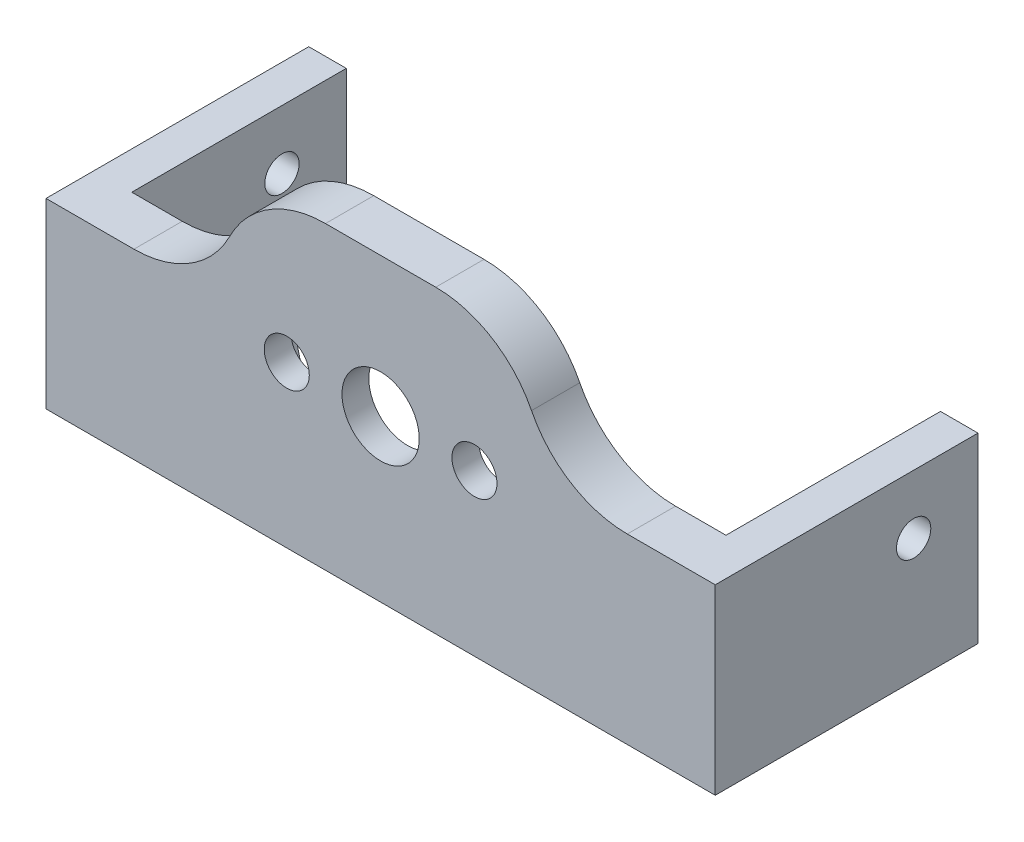
from build123d import *

# Parameters (mm, degrees)
BOSS_EXTRUDE1_DEPTH = 4.5
SKETCH4_R           = 12.55
CUT_EXTRUDE1_DEPTH  = 2
CUT_EXTRUDE2_REACH  = 42.016
SKETCH5_R           = 2.1
SKETCH5_R_2         = 3.6
SKETCH8_W           = 3.5
SKETCH8_H           = 17
BOSS_EXTRUDE3_DEPTH = 20
FILLET3_R           = 10
FILLET4_R           = 10
SKETCH9_R           = 1.6
CUT_EXTRUDE3_DEPTH  = 68.190127898


with BuildPart() as part:
    # Sketch3 → Boss-Extrude1 (new body)
    with BuildSketch(Plane.XY):
        Polygon((-7.128665208, 13.142231947), (18.871334792, 13.142231947), (18.871334792, 2.142231947), (37.071334792, 2.142231947), (37.071334792, -14.857768053), (-25.328665208, -14.857768053), (-25.328665208, 2.142231947), (-7.128665208, 2.142231947), align=None)
    extrude(amount=BOSS_EXTRUDE1_DEPTH)

    # Sketch4 → Cut-Extrude1 (cut)
    with BuildSketch(Plane(origin=(0, 0, 0), x_dir=(-1, 0, 0), z_dir=(0, 0, -1))):
        with Locations((-5.871334792, 0.142231947)):
            Circle(SKETCH4_R)
    extrude(amount=-CUT_EXTRUDE1_DEPTH, mode=Mode.SUBTRACT)

    # Sketch5 → Cut-Extrude2 (cut, up to next)
    with BuildSketch(Plane(origin=(0, 0, 2), x_dir=(-1, 0, 0), z_dir=(0, 0, -1)), mode=Mode.PRIVATE) as cut_extrude2_sk1:
        with Locations((-14.621334792, 0.142231947)):
            Circle(SKETCH5_R)
    cut_extrude2_tool1 = extrude(cut_extrude2_sk1.sketch, amount=-CUT_EXTRUDE2_REACH, mode=Mode.PRIVATE) & part.part
    # Sketch5 → Cut-Extrude2 (cut, up to next)
    with BuildSketch(Plane(origin=(0, 0, 2), x_dir=(-1, 0, 0), z_dir=(0, 0, -1)), mode=Mode.PRIVATE) as cut_extrude2_sk2:
        with Locations(Location((2.878665208, 0.142231947, 0), (0, 0, 180))):
            Circle(SKETCH5_R)
    cut_extrude2_tool2 = extrude(cut_extrude2_sk2.sketch, amount=-CUT_EXTRUDE2_REACH, mode=Mode.PRIVATE) & part.part
    # Sketch5 → Cut-Extrude2 (cut, up to next)
    with BuildSketch(Plane(origin=(0, 0, 2), x_dir=(-1, 0, 0), z_dir=(0, 0, -1)), mode=Mode.PRIVATE) as cut_extrude2_sk3:
        with Locations((-5.871334792, 0.142231947)):
            Circle(SKETCH5_R_2)
    cut_extrude2_tool3 = extrude(cut_extrude2_sk3.sketch, amount=-CUT_EXTRUDE2_REACH, mode=Mode.PRIVATE) & part.part
    add(cut_extrude2_tool1.solids().sort_by_distance((14.621335, 0.142232, 2))[0], mode=Mode.SUBTRACT)
    add(cut_extrude2_tool2.solids().sort_by_distance((-2.878665, 0.142232, 2))[0], mode=Mode.SUBTRACT)
    add(cut_extrude2_tool3.solids().sort_by_distance((5.871335, 0.142232, 2))[0], mode=Mode.SUBTRACT)

    # Sketch8 → Boss-Extrude3 (add)
    with BuildSketch(Plane(origin=(0, 0, 0), x_dir=(-1, 0, 0), z_dir=(0, 0, -1))):
        with Locations((-35.321334792, -6.357768053)):
            Rectangle(SKETCH8_W, SKETCH8_H)
        with Locations((23.578665208, -6.357768053)):
            Rectangle(SKETCH8_W, SKETCH8_H)
    extrude(amount=BOSS_EXTRUDE3_DEPTH)

    # Fillet3
    fillet3_edges = [part.edges().sort_by_distance(p)[0] for p in [
        (-7.128665208, 2.142231947, 2.25),
        (18.871334792, 2.142231947, 2.25),
    ]]
    fillet(fillet3_edges, radius=FILLET3_R)

    # Fillet4
    fillet4_edges = [part.edges().sort_by_distance(p)[0] for p in [
        (-7.128665208, 13.142231947, 2.25),
        (18.871334792, 13.142231947, 2.25),
    ]]
    fillet(fillet4_edges, radius=FILLET4_R)

    # Sketch9 → Cut-Extrude3 (cut, through all)
    with BuildSketch(Plane(origin=(37.071334792, 0, 0), x_dir=(0, 0, -1), z_dir=(1, 0, 0))):
        with Locations((14, -3.357768053)):
            Circle(SKETCH9_R)
    extrude(amount=-CUT_EXTRUDE3_DEPTH, mode=Mode.SUBTRACT)


solid = part.part
